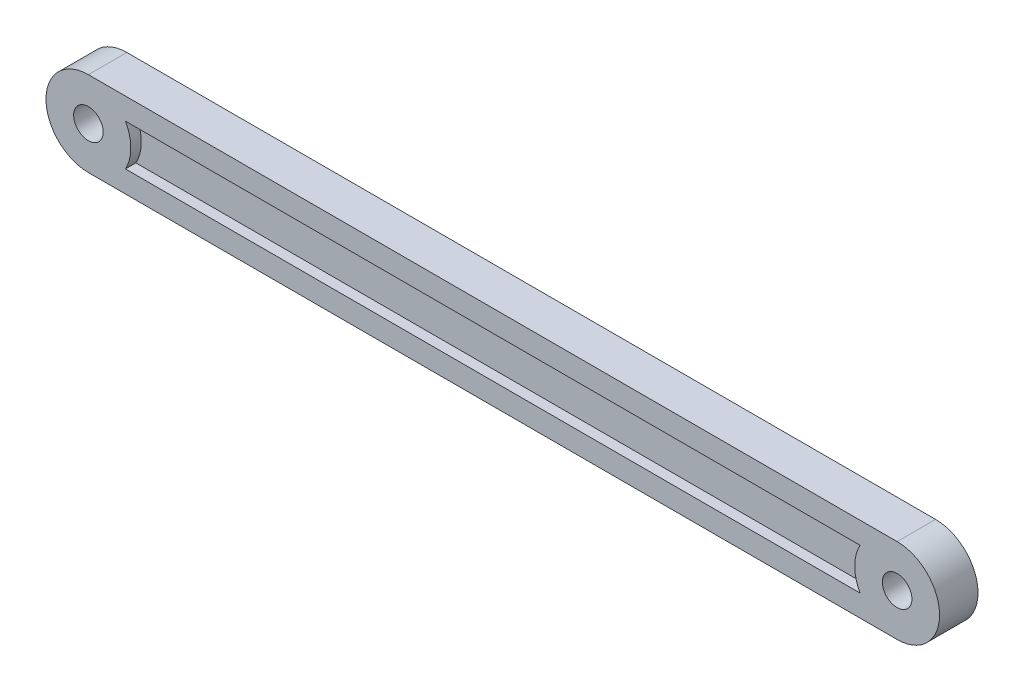
from build123d import *

# Parameters (mm, degrees)
SKETCH1_R           = 1.5
BOSS_EXTRUDE1_DEPTH = 1.95
CUT_EXTRUDE1_DEPTH  = 1.06


with BuildPart() as part:
    # Sketch1 → Boss-Extrude1 (new, symmetric)
    with BuildSketch(Plane.XY):
        with BuildLine():
            Line((41, -4.3), (-41, -4.3))
            ThreePointArc((-41, -4.3), (-45.3, 0), (-41, 4.3))
            Line((-41, 4.3), (41, 4.3))
            ThreePointArc((41, 4.3), (45.3, 0), (41, -4.3))
        make_face()
        with Locations((-41, 0)):
            Circle(SKETCH1_R, mode=Mode.SUBTRACT)
        with Locations((41, 0)):
            Circle(SKETCH1_R, mode=Mode.SUBTRACT)
    extrude(amount=BOSS_EXTRUDE1_DEPTH, both=True)

    # Sketch2 → Cut-Extrude1 (cut)
    with BuildSketch(Plane.XY.offset(1.95)):
        with BuildLine():
            ThreePointArc((37.247667392, -2.1), (36.7, 0), (37.247667392, 2.1))
            Line((37.247667392, 2.1), (-37.247667392, 2.1))
            ThreePointArc((-37.247667392, 2.1), (-36.83916894, 1.08511976), (-36.7, 0))
            ThreePointArc((-36.7, 0), (-36.83916894, -1.08511976), (-37.247667392, -2.1))
            Line((-37.247667392, -2.1), (37.247667392, -2.1))
        make_face()
    cut_extrude1 = extrude(amount=-CUT_EXTRUDE1_DEPTH, mode=Mode.SUBTRACT)

    # Mirror1: Cut-Extrude1 across plane
    add(cut_extrude1.mirror(Plane.XY), mode=Mode.SUBTRACT)


solid = part.part
